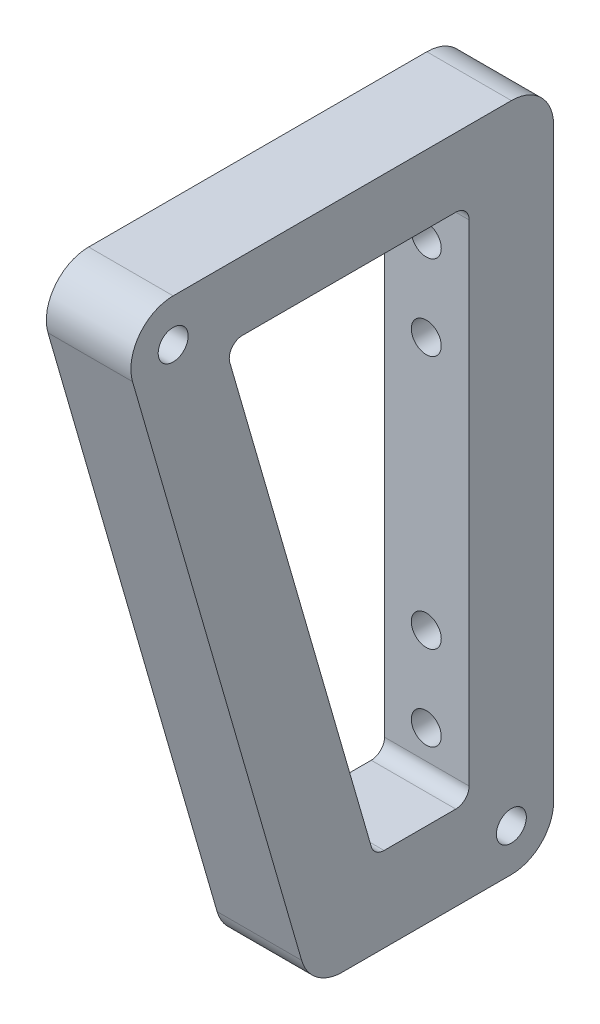
from build123d import *

# Parameters (mm, degrees)
SKETCH1_R           = 2.25
BOSS_EXTRUDE1_DEPTH = 12.7
CUT_EXTRUDE1_REACH  = 117.6
SKETCH3_R           = 2.25
FILLET3_R           = 6.35
FILLET4_R           = 2


with BuildPart() as part:
    # Sketch1 → Boss-Extrude1 (new body)
    with BuildSketch(Plane(origin=(0, 0, 0), x_dir=(0, 0, -1), z_dir=(1, 0, 0))):
        Polygon((6.35, -6.35), (6.35, 94.338181024), (-59.242376653, 94.338181024), (-30.176202444, -6.35), align=None)
        Circle(SKETCH1_R, mode=Mode.SUBTRACT)
        with Locations((-50.8, 87.988181024)):
            Circle(SKETCH1_R, mode=Mode.SUBTRACT)
        Polygon((-6.35, 6.35), (-6.35, 83.988181024), (-43.036009913, 83.988181024), (-20.623797556, 6.35), align=None, mode=Mode.SUBTRACT)
    extrude(amount=BOSS_EXTRUDE1_DEPTH)

    # Sketch3 → Cut-Extrude1 (cut, up to next)
    with BuildSketch(Plane(origin=(0, 0, -6.35), x_dir=(-1, 0, 0), z_dir=(0, 0, -1)), mode=Mode.PRIVATE) as cut_extrude1_sk1:
        with Locations(Location((-6.269939037, 76.2, 0), (0, 0, 90))):
            Circle(SKETCH3_R)
    cut_extrude1_tool1 = extrude(cut_extrude1_sk1.sketch, amount=-CUT_EXTRUDE1_REACH, mode=Mode.PRIVATE) & part.part
    # Sketch3 → Cut-Extrude1 (cut, up to next)
    with BuildSketch(Plane(origin=(0, 0, -6.35), x_dir=(-1, 0, 0), z_dir=(0, 0, -1)), mode=Mode.PRIVATE) as cut_extrude1_sk2:
        with Locations(Location((-6.269939037, 63.5, 0), (0, 0, 90))):
            Circle(SKETCH3_R)
    cut_extrude1_tool2 = extrude(cut_extrude1_sk2.sketch, amount=-CUT_EXTRUDE1_REACH, mode=Mode.PRIVATE) & part.part
    # Sketch3 → Cut-Extrude1 (cut, up to next)
    with BuildSketch(Plane(origin=(0, 0, -6.35), x_dir=(-1, 0, 0), z_dir=(0, 0, -1)), mode=Mode.PRIVATE) as cut_extrude1_sk3:
        with Locations(Location((-6.269939037, 12.7, 0), (0, 0, 90))):
            Circle(SKETCH3_R)
    cut_extrude1_tool3 = extrude(cut_extrude1_sk3.sketch, amount=-CUT_EXTRUDE1_REACH, mode=Mode.PRIVATE) & part.part
    # Sketch3 → Cut-Extrude1 (cut, up to next)
    with BuildSketch(Plane(origin=(0, 0, -6.35), x_dir=(-1, 0, 0), z_dir=(0, 0, -1)), mode=Mode.PRIVATE) as cut_extrude1_sk4:
        with Locations(Location((-6.269939037, 25.4, 0), (0, 0, 90))):
            Circle(SKETCH3_R)
    cut_extrude1_tool4 = extrude(cut_extrude1_sk4.sketch, amount=-CUT_EXTRUDE1_REACH, mode=Mode.PRIVATE) & part.part
    add(cut_extrude1_tool1.solids().sort_by_distance((6.269939, 76.2, -6.35))[0], mode=Mode.SUBTRACT)
    add(cut_extrude1_tool2.solids().sort_by_distance((6.269939, 63.5, -6.35))[0], mode=Mode.SUBTRACT)
    add(cut_extrude1_tool3.solids().sort_by_distance((6.269939, 12.7, -6.35))[0], mode=Mode.SUBTRACT)
    add(cut_extrude1_tool4.solids().sort_by_distance((6.269939, 25.4, -6.35))[0], mode=Mode.SUBTRACT)

    # Fillet3
    fillet3_edges = [part.edges().sort_by_distance(p)[0] for p in [
        (6.35, 94.338181024, 59.242376653),
        (6.35, 94.338181024, -6.35),
        (6.35, -6.35, -6.35),
        (6.35, -6.35, 30.176202444),
    ]]
    fillet(fillet3_edges, radius=FILLET3_R)

    # Fillet4
    fillet4_edges = [part.edges().sort_by_distance(p)[0] for p in [
        (6.35, 83.988181024, 43.036009913),
        (6.35, 6.35, 20.623797556),
        (6.35, 6.35, 6.35),
        (6.35, 83.988181024, 6.35),
    ]]
    fillet(fillet4_edges, radius=FILLET4_R)


solid = part.part
